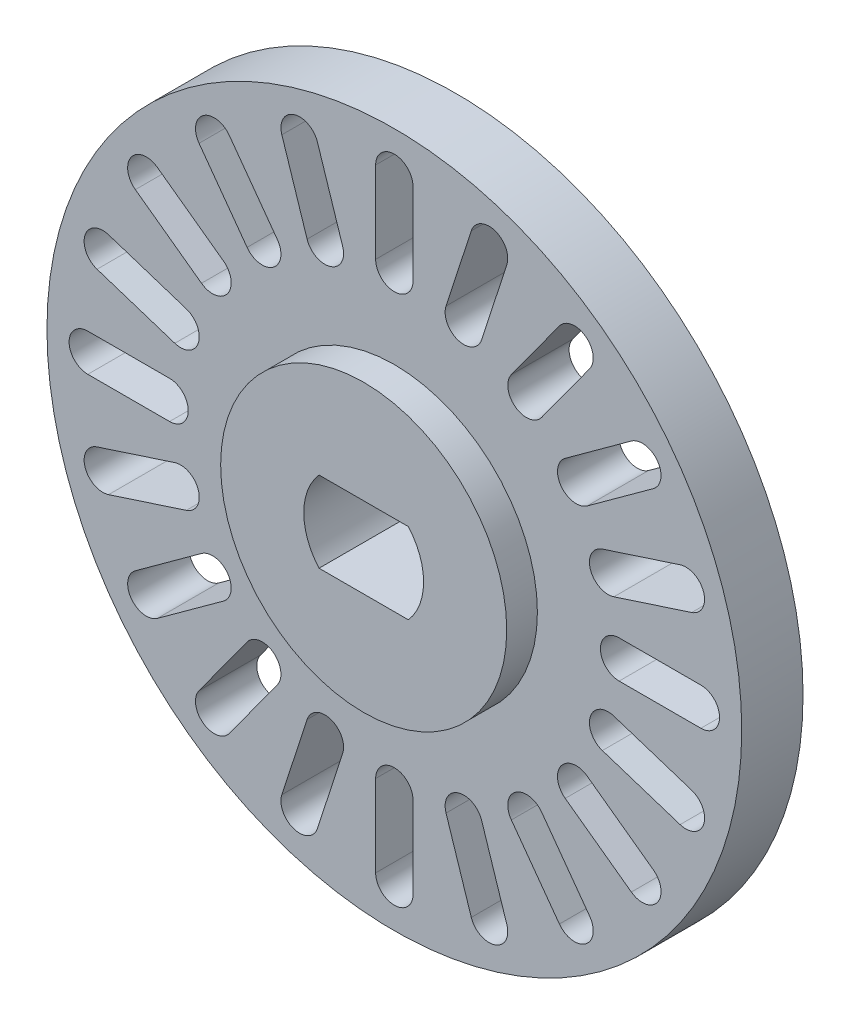
from build123d import *

# Parameters (mm, degrees)
SKETCH4_R           = 17
BOSS_EXTRUDE2_DEPTH = 3
SKETCH5_R           = 7
BOSS_EXTRUDE3_DEPTH = 1.5
CUT_EXTRUDE2_DEPTH  = 25.459149617
CUT_EXTRUDE3_DEPTH  = 25.228082879


with BuildPart() as part:
    # Sketch4 → Boss-Extrude2 (new body)
    with BuildSketch(Plane.XY):
        Circle(SKETCH4_R)
    extrude(amount=BOSS_EXTRUDE2_DEPTH)

    # Sketch5 → Boss-Extrude3 (add)
    with BuildSketch(Plane.XY.offset(3)):
        Circle(SKETCH5_R)
    extrude(amount=BOSS_EXTRUDE3_DEPTH)

    # Sketch3 → Cut-Extrude2 (cut, through all)
    with BuildSketch(Plane(origin=(0, 0, 0), x_dir=(-1, 0, 0), z_dir=(0, 0, 1))):
        with BuildLine():
            Line((-2.185, 1.975), (2.185, 1.975))
            ThreePointArc((2.185, 1.975), (2.931974702, 0), (2.185, -1.975))
            Line((2.185, -1.975), (-2.185, -1.975))
            ThreePointArc((-2.185, -1.975), (-2.931974702, 0), (-2.185, 1.975))
        make_face()
    extrude(amount=CUT_EXTRUDE2_DEPTH, mode=Mode.SUBTRACT)

    # Sketch6 → Cut-Extrude3 (cut, through all)
    with BuildSketch(Plane.XY.offset(3)):
        with BuildLine():
            Line((11, 0.914805145), (15, 0.914805145))
            ThreePointArc((15, 0.914805145), (15.914805145, 0), (15, -0.914805145))
            Line((15, -0.914805145), (11, -0.914805145))
            ThreePointArc((11, -0.914805145), (10.085194855, 0), (11, 0.914805145))
        make_face()
        with BuildLine():
            Line((10.744312015, -2.529155544), (14.548538081, -3.765223522))
            ThreePointArc((14.548538081, -3.765223522), (15.135879138, -4.917945252), (13.983157408, -5.50528631))
            Line((13.983157408, -5.50528631), (10.178931343, -4.269218332))
            ThreePointArc((10.178931343, -4.269218332), (9.591590285, -3.116496602), (10.744312015, -2.529155544))
        make_face()
        with BuildLine():
            Line((9.436895911, -5.725544867), (12.672963888, -8.076685876))
            ThreePointArc((12.672963888, -8.076685876), (12.875347824, -9.354487757), (11.597545943, -9.556871693))
            Line((11.597545943, -9.556871693), (8.361477965, -7.205730684))
            ThreePointArc((8.361477965, -7.205730684), (8.15909403, -5.927928803), (9.436895911, -5.725544867))
        make_face()
        with BuildLine():
            Line((7.205730684, -8.361477965), (9.556871693, -11.597545943))
            ThreePointArc((9.556871693, -11.597545943), (9.354487757, -12.875347824), (8.076685876, -12.672963888))
            Line((8.076685876, -12.672963888), (5.725544867, -9.436895911))
            ThreePointArc((5.725544867, -9.436895911), (5.927928803, -8.15909403), (7.205730684, -8.361477965))
        make_face()
        with BuildLine():
            Line((4.269218332, -10.178931343), (5.50528631, -13.983157408))
            ThreePointArc((5.50528631, -13.983157408), (4.917945252, -15.135879138), (3.765223522, -14.548538081))
            Line((3.765223522, -14.548538081), (2.529155544, -10.744312015))
            ThreePointArc((2.529155544, -10.744312015), (3.116496602, -9.591590285), (4.269218332, -10.178931343))
        make_face()
        with BuildLine():
            Line((0.914805145, -11), (0.914805145, -15))
            ThreePointArc((0.914805145, -15), (0, -15.914805145), (-0.914805145, -15))
            Line((-0.914805145, -15), (-0.914805145, -11))
            ThreePointArc((-0.914805145, -11), (0, -10.085194855), (0.914805145, -11))
        make_face()
        with BuildLine():
            Line((-2.529155544, -10.744312015), (-3.765223522, -14.548538081))
            ThreePointArc((-3.765223522, -14.548538081), (-4.917945252, -15.135879138), (-5.50528631, -13.983157408))
            Line((-5.50528631, -13.983157408), (-4.269218332, -10.178931343))
            ThreePointArc((-4.269218332, -10.178931343), (-3.116496602, -9.591590285), (-2.529155544, -10.744312015))
        make_face()
        with BuildLine():
            Line((-5.725544867, -9.436895911), (-8.076685876, -12.672963888))
            ThreePointArc((-8.076685876, -12.672963888), (-9.354487757, -12.875347824), (-9.556871693, -11.597545943))
            Line((-9.556871693, -11.597545943), (-7.205730684, -8.361477965))
            ThreePointArc((-7.205730684, -8.361477965), (-5.927928803, -8.15909403), (-5.725544867, -9.436895911))
        make_face()
        with BuildLine():
            Line((-8.361477965, -7.205730684), (-11.597545943, -9.556871693))
            ThreePointArc((-11.597545943, -9.556871693), (-12.875347824, -9.354487757), (-12.672963888, -8.076685876))
            Line((-12.672963888, -8.076685876), (-9.436895911, -5.725544867))
            ThreePointArc((-9.436895911, -5.725544867), (-8.15909403, -5.927928803), (-8.361477965, -7.205730684))
        make_face()
        with BuildLine():
            Line((-10.178931343, -4.269218332), (-13.983157408, -5.50528631))
            ThreePointArc((-13.983157408, -5.50528631), (-15.135879138, -4.917945252), (-14.548538081, -3.765223522))
            Line((-14.548538081, -3.765223522), (-10.744312015, -2.529155544))
            ThreePointArc((-10.744312015, -2.529155544), (-9.591590285, -3.116496602), (-10.178931343, -4.269218332))
        make_face()
        with BuildLine():
            Line((-11, -0.914805145), (-15, -0.914805145))
            ThreePointArc((-15, -0.914805145), (-15.914805145, 0), (-15, 0.914805145))
            Line((-15, 0.914805145), (-11, 0.914805145))
            ThreePointArc((-11, 0.914805145), (-10.085194855, 0), (-11, -0.914805145))
        make_face()
        with BuildLine():
            Line((-10.744312015, 2.529155544), (-14.548538081, 3.765223522))
            ThreePointArc((-14.548538081, 3.765223522), (-15.135879138, 4.917945252), (-13.983157408, 5.50528631))
            Line((-13.983157408, 5.50528631), (-10.178931343, 4.269218332))
            ThreePointArc((-10.178931343, 4.269218332), (-9.591590285, 3.116496602), (-10.744312015, 2.529155544))
        make_face()
        with BuildLine():
            Line((-9.436895911, 5.725544867), (-12.672963888, 8.076685876))
            ThreePointArc((-12.672963888, 8.076685876), (-12.875347824, 9.354487757), (-11.597545943, 9.556871693))
            Line((-11.597545943, 9.556871693), (-8.361477965, 7.205730684))
            ThreePointArc((-8.361477965, 7.205730684), (-8.15909403, 5.927928803), (-9.436895911, 5.725544867))
        make_face()
        with BuildLine():
            Line((-7.205730684, 8.361477965), (-9.556871693, 11.597545943))
            ThreePointArc((-9.556871693, 11.597545943), (-9.354487757, 12.875347824), (-8.076685876, 12.672963888))
            Line((-8.076685876, 12.672963888), (-5.725544867, 9.436895911))
            ThreePointArc((-5.725544867, 9.436895911), (-5.927928803, 8.15909403), (-7.205730684, 8.361477965))
        make_face()
        with BuildLine():
            Line((-4.269218332, 10.178931343), (-5.50528631, 13.983157408))
            ThreePointArc((-5.50528631, 13.983157408), (-4.917945252, 15.135879138), (-3.765223522, 14.548538081))
            Line((-3.765223522, 14.548538081), (-2.529155544, 10.744312015))
            ThreePointArc((-2.529155544, 10.744312015), (-3.116496602, 9.591590285), (-4.269218332, 10.178931343))
        make_face()
        with BuildLine():
            Line((-0.914805145, 11), (-0.914805145, 15))
            ThreePointArc((-0.914805145, 15), (0, 15.914805145), (0.914805145, 15))
            Line((0.914805145, 15), (0.914805145, 11))
            ThreePointArc((0.914805145, 11), (0, 10.085194855), (-0.914805145, 11))
        make_face()
        with BuildLine():
            Line((2.529155544, 10.744312015), (3.765223522, 14.548538081))
            ThreePointArc((3.765223522, 14.548538081), (4.917945252, 15.135879138), (5.50528631, 13.983157408))
            Line((5.50528631, 13.983157408), (4.269218332, 10.178931343))
            ThreePointArc((4.269218332, 10.178931343), (3.116496602, 9.591590285), (2.529155544, 10.744312015))
        make_face()
        with BuildLine():
            Line((5.725544867, 9.436895911), (8.076685876, 12.672963888))
            ThreePointArc((8.076685876, 12.672963888), (9.354487757, 12.875347824), (9.556871693, 11.597545943))
            Line((9.556871693, 11.597545943), (7.205730684, 8.361477965))
            ThreePointArc((7.205730684, 8.361477965), (5.927928803, 8.15909403), (5.725544867, 9.436895911))
        make_face()
        with BuildLine():
            Line((8.361477965, 7.205730684), (11.597545943, 9.556871693))
            ThreePointArc((11.597545943, 9.556871693), (12.875347824, 9.354487757), (12.672963888, 8.076685876))
            Line((12.672963888, 8.076685876), (9.436895911, 5.725544867))
            ThreePointArc((9.436895911, 5.725544867), (8.15909403, 5.927928803), (8.361477965, 7.205730684))
        make_face()
        with BuildLine():
            Line((10.178931343, 4.269218332), (13.983157408, 5.50528631))
            ThreePointArc((13.983157408, 5.50528631), (15.135879138, 4.917945252), (14.548538081, 3.765223522))
            Line((14.548538081, 3.765223522), (10.744312015, 2.529155544))
            ThreePointArc((10.744312015, 2.529155544), (9.591590285, 3.116496602), (10.178931343, 4.269218332))
        make_face()
    extrude(amount=-CUT_EXTRUDE3_DEPTH, mode=Mode.SUBTRACT)


solid = part.part
